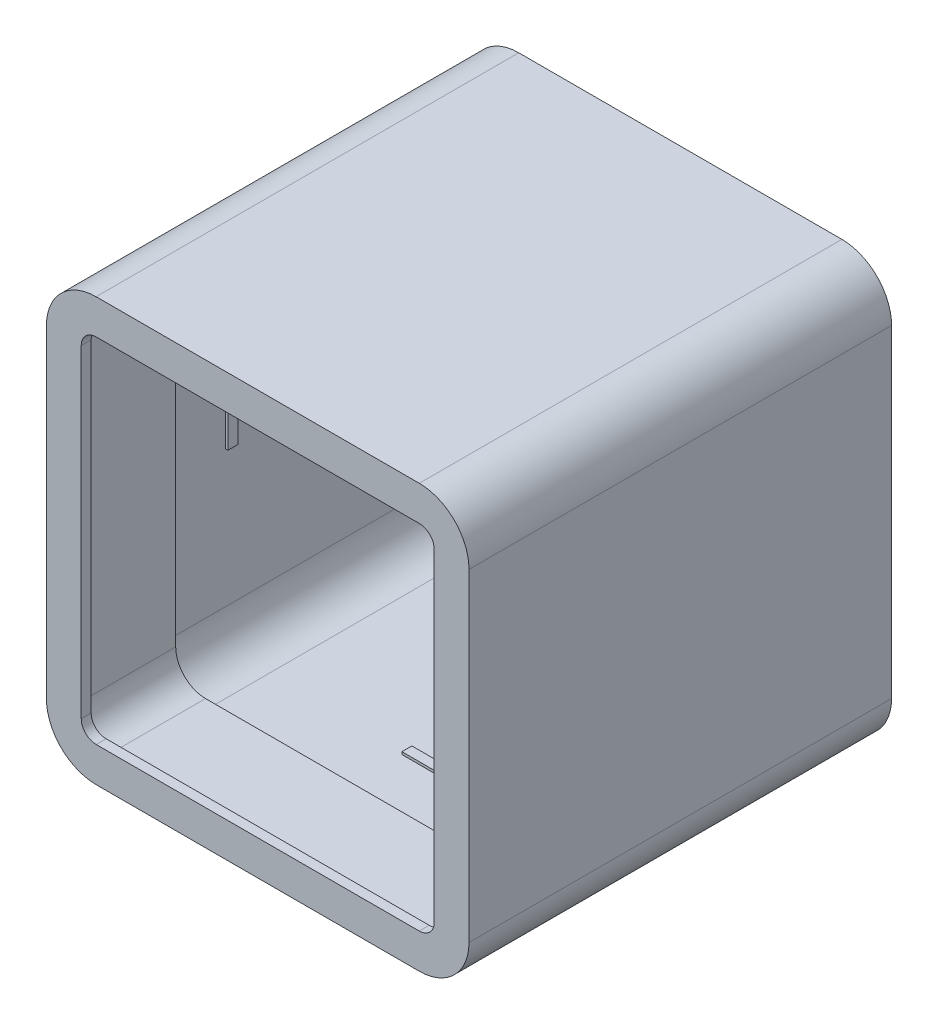
from build123d import *

# Parameters (mm, degrees)
SKETCH1_W           = 85
SKETCH1_H           = 85
BOSS_EXTRUDE1_DEPTH = 85
FILLET1_R           = 10
SHELL1_T            = 2
CUT_EXTRUDE1_REACH  = 106.103
BOSS_EXTRUDE2_DEPTH = 20
SKETCH4_W           = 2
SKETCH4_H           = 10
BOSS_EXTRUDE3_DEPTH = 0.5
CIRPATTERN1_COUNT   = 4


with BuildPart() as part:
    # Sketch1 → Boss-Extrude1 (new body)
    with BuildSketch(Plane.XY):
        Rectangle(SKETCH1_W, SKETCH1_H)
    extrude(amount=BOSS_EXTRUDE1_DEPTH)

    # Fillet1
    fillet1_edges = [part.edges().sort_by_distance(p)[0] for p in [
        (-42.5, 42.5, 42.5),
        (-42.5, -42.5, 42.5),
        (42.5, -42.5, 42.5),
        (42.5, 42.5, 42.5),
    ]]
    fillet(fillet1_edges, radius=FILLET1_R)

    # Shell1 (no face opened: a closed hollow body)
    add(offset(amount=-SHELL1_T, mode=Mode.PRIVATE), mode=Mode.SUBTRACT)

    # Sketch2 → Cut-Extrude1 (cut, up to next)
    with BuildSketch(Plane.XY.offset(85), mode=Mode.PRIVATE) as cut_extrude1_sk1:
        with BuildLine():
            Line((32.5, 35.5), (-32.5, 35.5))
            ThreePointArc((-32.5, 35.5), (-34.621320344, 34.621320344), (-35.5, 32.5))
            Line((-35.5, 32.5), (-35.5, -32.5))
            ThreePointArc((-35.5, -32.5), (-34.621320344, -34.621320344), (-32.5, -35.5))
            Line((-32.5, -35.5), (32.5, -35.5))
            ThreePointArc((32.5, -35.5), (34.621320344, -34.621320344), (35.5, -32.5))
            Line((35.5, -32.5), (35.5, 32.5))
            ThreePointArc((35.5, 32.5), (34.621320344, 34.621320344), (32.5, 35.5))
        make_face()
    cut_extrude1_tool1 = extrude(cut_extrude1_sk1.sketch, amount=-CUT_EXTRUDE1_REACH, mode=Mode.PRIVATE) & part.part
    add(cut_extrude1_tool1.solids().sort_by_distance((0, 0, 85))[0], mode=Mode.SUBTRACT)

    # Sketch3 → Boss-Extrude2 (add)
    with BuildSketch(Plane(origin=(0, 0, 83), x_dir=(-1, 0, 0), z_dir=(0, 0, -1))):
        with BuildLine():
            Line((-32.5, 40.5), (32.5, 40.5))
            ThreePointArc((32.5, 40.5), (38.156854249, 38.156854249), (40.5, 32.5))
            Line((40.5, 32.5), (40.5, -32.5))
            ThreePointArc((40.5, -32.5), (38.156854249, -38.156854249), (32.5, -40.5))
            Line((32.5, -40.5), (-32.5, -40.5))
            ThreePointArc((-32.5, -40.5), (-38.156854249, -38.156854249), (-40.5, -32.5))
            Line((-40.5, -32.5), (-40.5, 32.5))
            ThreePointArc((-40.5, 32.5), (-38.156854249, 38.156854249), (-32.5, 40.5))
        make_face()
        with BuildLine():
            Line((38.5, -32.5), (38.5, 32.5))
            ThreePointArc((38.5, 32.5), (36.742640687, 36.742640687), (32.5, 38.5))
            Line((32.5, 38.5), (-32.5, 38.5))
            ThreePointArc((-32.5, 38.5), (-36.742640687, 36.742640687), (-38.5, 32.5))
            Line((-38.5, 32.5), (-38.5, -32.5))
            ThreePointArc((-38.5, -32.5), (-36.742640687, -36.742640687), (-32.5, -38.5))
            Line((-32.5, -38.5), (32.5, -38.5))
            ThreePointArc((32.5, -38.5), (36.742640687, -36.742640687), (38.5, -32.5))
        make_face(mode=Mode.SUBTRACT)
    extrude(amount=BOSS_EXTRUDE2_DEPTH)

    # Sketch4 → Boss-Extrude3 (add)
    with BuildSketch(Plane.ZY.offset(-40.5)):
        with Locations((50, 0)):
            Rectangle(SKETCH4_W, SKETCH4_H)
    boss_extrude3 = extrude(amount=BOSS_EXTRUDE3_DEPTH)

    # CirPattern1: Boss-Extrude3 ×4 about axis
    cirpattern1_axis = Axis((0, 0, -4.25), (0, 0, 1))
    for i in range(1, CIRPATTERN1_COUNT):
        add(boss_extrude3.rotate(cirpattern1_axis, i * 360 / CIRPATTERN1_COUNT))


solid = part.part
